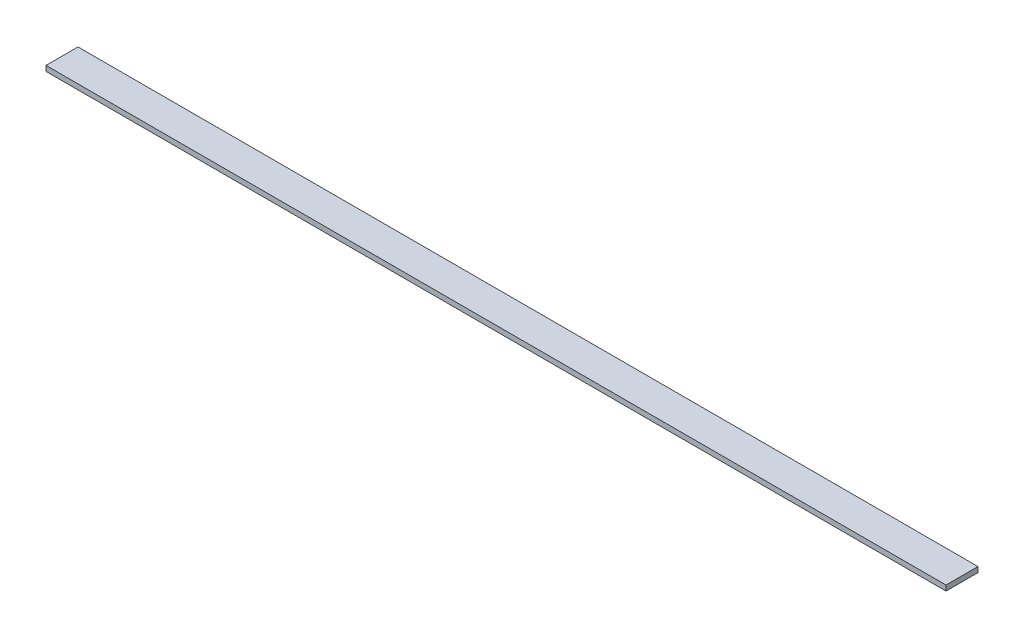
from build123d import *

# Parameters (mm, degrees)
SKETCH1_W          = 1752.6
SKETCH1_H          = 62.2808
BOSS_EXTRUDE_DEPTH = 5.1054


with BuildPart() as part:
    # Sketch1 → Boss-Extrude (new, symmetric)
    with BuildSketch(Plane(origin=(0, 0, 0), x_dir=(1, 0, 0), z_dir=(0, 1, 0))):
        with Locations((-876.3, -31.1404)):
            Rectangle(SKETCH1_W, SKETCH1_H)
    extrude(amount=BOSS_EXTRUDE_DEPTH, both=True)


solid = part.part
